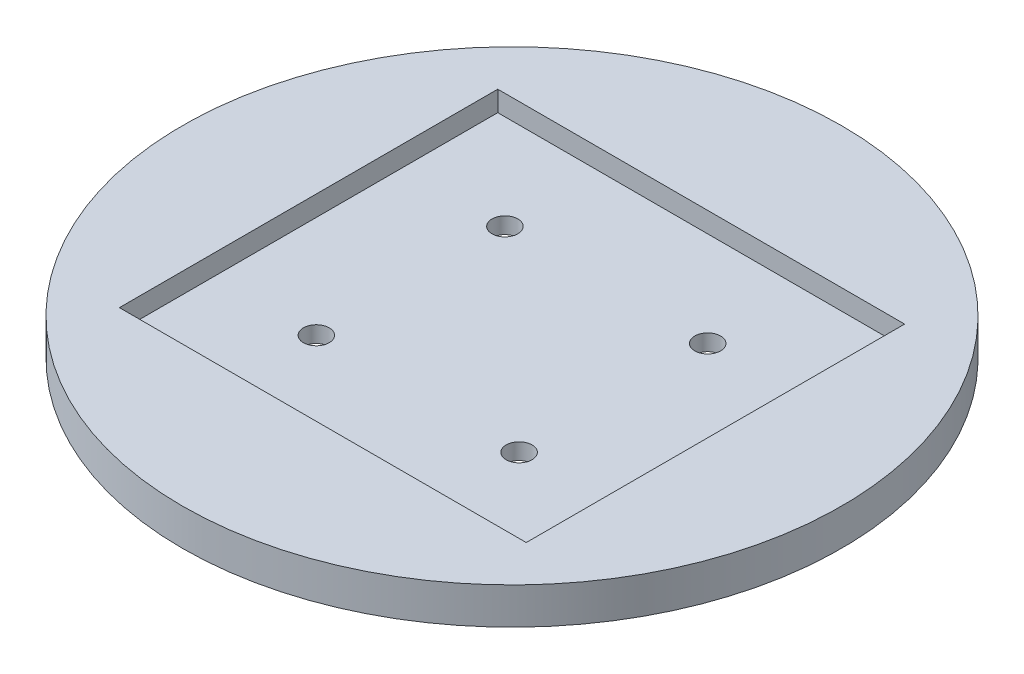
from build123d import *

# Parameters (mm, degrees)
SKETCH1_R           = 81.001543195
BOSS_EXTRUDE1_DEPTH = 9
SKETCH2_W           = 100
SKETCH2_H           = 93
SKETCH2_R           = 3.175
CUT_EXTRUDE1_DEPTH  = 5
SKETCH2_3_R         = 3.175
CUT_EXTRUDE2_DEPTH  = 115.906483716


with BuildPart() as part:
    # Sketch1 → Boss-Extrude1 (new body)
    with BuildSketch(Plane(origin=(0, 0, 0), x_dir=(1, 0, 0), z_dir=(0, 1, 0))):
        Circle(SKETCH1_R)
    extrude(amount=BOSS_EXTRUDE1_DEPTH)

    # Sketch2 → Cut-Extrude1 (cut)
    with BuildSketch(Plane(origin=(0, 9, 0), x_dir=(1, 0, 0), z_dir=(0, 1, 0))):
        Rectangle(SKETCH2_W, SKETCH2_H)
        with Locations((-24.919571738, -23.175201717)):
            Circle(SKETCH2_R, mode=Mode.SUBTRACT)
        with Locations((24.919571738, -23.175201717)):
            Circle(SKETCH2_R, mode=Mode.SUBTRACT)
        with Locations((-24.919571738, 23.175201717)):
            Circle(SKETCH2_R, mode=Mode.SUBTRACT)
        with Locations((24.919571738, 23.175201717)):
            Circle(SKETCH2_R, mode=Mode.SUBTRACT)
    extrude(amount=-CUT_EXTRUDE1_DEPTH, mode=Mode.SUBTRACT)

    # Sketch2<3> → Cut-Extrude2 (cut, through all)
    with BuildSketch(Plane(origin=(0, 9, 0), x_dir=(1, 0, 0), z_dir=(0, 1, 0))):
        with Locations((-24.919571738, -23.175201717)):
            Circle(SKETCH2_3_R)
        with Locations((24.919571738, -23.175201717)):
            Circle(SKETCH2_3_R)
        with Locations((24.919571738, 23.175201717)):
            Circle(SKETCH2_3_R)
        with Locations((-24.919571738, 23.175201717)):
            Circle(SKETCH2_3_R)
    extrude(amount=-CUT_EXTRUDE2_DEPTH, mode=Mode.SUBTRACT)


solid = part.part
